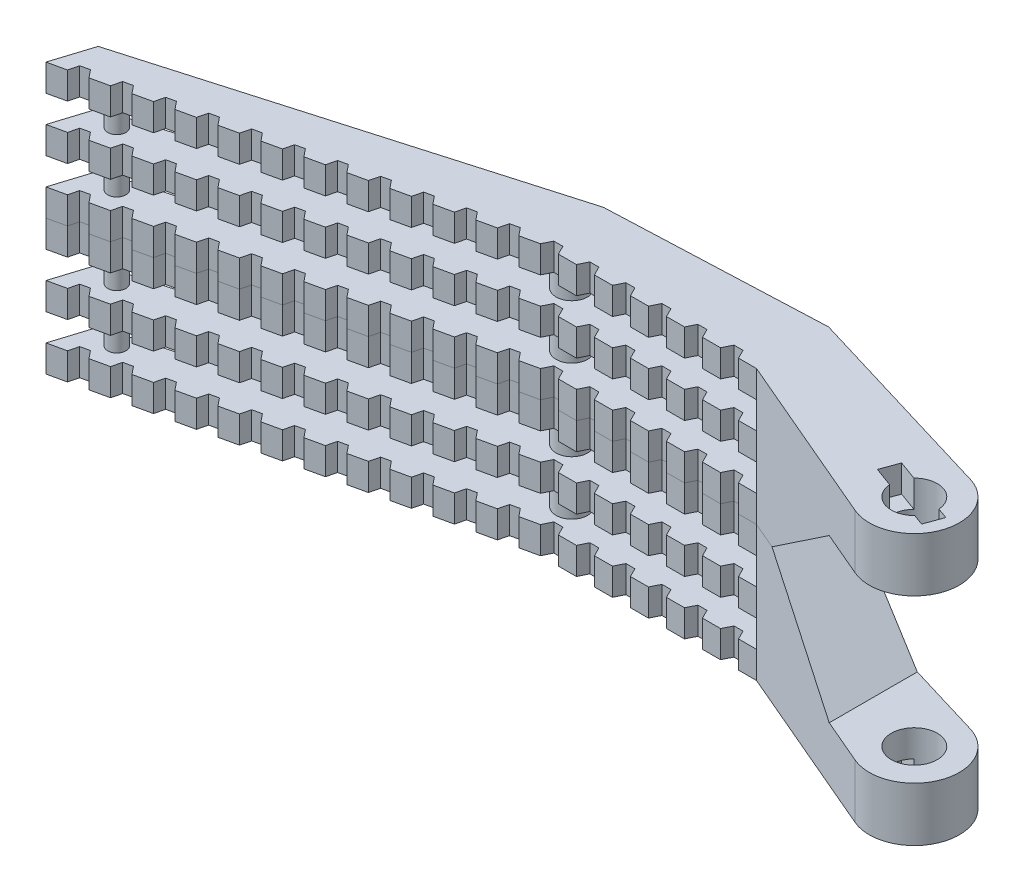
from build123d import *

# Parameters (mm, degrees)
EXTRUDE_2_DEPTH                = 15
EXTRUDE_2_DEPTH_BACK           = 15
CUT_EXTRUDE_7_DEPTH            = 92.973195193
CUT_EXTRUDE_7_DEPTH_BACK       = 92.973195193
CUT_EXTRUDE_8_DEPTH            = 92.973195193
CUT_EXTRUDE_8_DEPTH_BACK       = 92.973195193
SKETCH_3_W                     = 100
SKETCH_3_H                     = 3
EXTRUDE_START                  = -27
SKETCH_4_R                     = 1.75
SKETCH_4_R_2                   = 1
EXTRUDE_3_DEPTH                = 24
SKETCH_5_R                     = 2.55
CUT_EXTRUDE_2_DEPTH            = 96.572321485
CUT_EXTRUDE_5_DEPTH            = 3
SPLIT_BODIES_1_SURFACE_1_BACK  = 102.234
SPLIT_BODIES_1_SURFACE_1_DEPTH = 204.468
SPLIT_BODIES_1_SURFACE_2_BACK  = 102.234
SPLIT_BODIES_1_SURFACE_2_DEPTH = 204.468


with BuildPart() as part:
    # 草图1 → 凸台-拉伸2 (new, two sides: drawn at the far end of the back side and taken through both)
    with BuildSketch(Plane(origin=(0, 0, 0), x_dir=(1, 0, 0), z_dir=(0, 1, 0)).offset(-EXTRUDE_2_DEPTH_BACK)):
        with BuildLine():
            Line((-1.965078437, -4.597658832), (-21.095395232, 3.57880106))
            Line((-21.095395232, 3.57880106), (-23.095395232, 3.57880106))
            Line((-23.095395232, 3.57880106), (-23.595395232, 4.57880106))
            Line((-23.595395232, 4.57880106), (-24.595395232, 4.57880106))
            Line((-24.595395232, 4.57880106), (-25.095395232, 3.57880106))
            Line((-25.095395232, 3.57880106), (-27.095395232, 3.57880106))
            Line((-27.095395232, 3.57880106), (-27.595395232, 4.57880106))
            Line((-27.595395232, 4.57880106), (-28.595395232, 4.57880106))
            Line((-28.595395232, 4.57880106), (-29.095395232, 3.57880106))
            Line((-29.095395232, 3.57880106), (-31.095395232, 3.57880106))
            Line((-31.095395232, 3.57880106), (-31.595395232, 4.57880106))
            Line((-31.595395232, 4.57880106), (-32.595395232, 4.57880106))
            Line((-32.595395232, 4.57880106), (-33.095395232, 3.57880106))
            Line((-33.095395232, 3.57880106), (-35.095395232, 3.57880106))
            Line((-35.095395232, 3.57880106), (-35.595395232, 4.57880106))
            Line((-35.595395232, 4.57880106), (-36.595395232, 4.57880106))
            Line((-36.595395232, 4.57880106), (-37.095395232, 3.57880106))
            Line((-37.095395232, 3.57880106), (-39.095395232, 3.57880106))
            Line((-39.095395232, 3.57880106), (-39.595395232, 4.57880106))
            Line((-39.595395232, 4.57880106), (-40.595395232, 4.57880106))
            Line((-40.595395232, 4.57880106), (-41.095395232, 3.57880106))
            Line((-41.095395232, 3.57880106), (-43.095395232, 3.57880106))
            Line((-43.095395232, 3.57880106), (-43.595395232, 4.57880106))
            Line((-43.595395232, 4.57880106), (-44.595395232, 4.57880106))
            Line((-44.595395232, 4.57880106), (-45.095395232, 3.57880106))
            Line((-45.095395232, 3.57880106), (-47.047769352, 3.144940144))
            Line((-47.047769352, 3.144940144), (-47.75279334, 4.012661975))
            Line((-47.75279334, 4.012661975), (-48.7289804, 3.795731517))
            Line((-48.7289804, 3.795731517), (-49.000143472, 2.711079228))
            Line((-49.000143472, 2.711079228), (-50.952517593, 2.277218313))
            Line((-50.952517593, 2.277218313), (-51.657541581, 3.144940144))
            Line((-51.657541581, 3.144940144), (-52.633728641, 2.928009686))
            Line((-52.633728641, 2.928009686), (-52.904891713, 1.843357397))
            Line((-52.904891713, 1.843357397), (-54.857265833, 1.409496481))
            Line((-54.857265833, 1.409496481), (-55.562289821, 2.277218313))
            Line((-55.562289821, 2.277218313), (-56.538476881, 2.060287855))
            Line((-56.538476881, 2.060287855), (-56.809639954, 0.975635566))
            Line((-56.809639954, 0.975635566), (-58.762014074, 0.54177465))
            Line((-58.762014074, 0.54177465), (-59.467038062, 1.409496481))
            Line((-59.467038062, 1.409496481), (-60.443225122, 1.192566024))
            Line((-60.443225122, 1.192566024), (-60.714388194, 0.107913735))
            Line((-60.714388194, 0.107913735), (-62.666762315, -0.325947181))
            Line((-62.666762315, -0.325947181), (-63.371786303, 0.54177465))
            Line((-63.371786303, 0.54177465), (-64.347973363, 0.324844192))
            Line((-64.347973363, 0.324844192), (-64.619136435, -0.759808097))
            Line((-64.619136435, -0.759808097), (-66.571510556, -1.193669012))
            Line((-66.571510556, -1.193669012), (-67.276534543, -0.325947181))
            Line((-67.276534543, -0.325947181), (-68.252721604, -0.542877639))
            Line((-68.252721604, -0.542877639), (-68.523884676, -1.627529928))
            Line((-68.523884676, -1.627529928), (-70.476258796, -2.061390844))
            Line((-70.476258796, -2.061390844), (-71.181282784, -1.193669012))
            Line((-71.181282784, -1.193669012), (-72.157469844, -1.41059947))
            Line((-72.157469844, -1.41059947), (-72.428632917, -2.495251759))
            Line((-72.428632917, -2.495251759), (-74.381007037, -2.929112675))
            Line((-74.381007037, -2.929112675), (-75.086031025, -2.061390844))
            Line((-75.086031025, -2.061390844), (-76.062218085, -2.278321301))
            Line((-76.062218085, -2.278321301), (-76.333381157, -3.362973591))
            Line((-76.333381157, -3.362973591), (-78.285755278, -3.796834506))
            Line((-78.285755278, -3.796834506), (-78.990779266, -2.929112675))
            Line((-78.990779266, -2.929112675), (-79.966966326, -3.146043133))
            Line((-79.966966326, -3.146043133), (-80.238129398, -4.230695422))
            Line((-80.238129398, -4.230695422), (-82.190503519, -4.664556337))
            Line((-82.190503519, -4.664556337), (-82.895527506, -3.796834506))
            Line((-82.895527506, -3.796834506), (-83.871714567, -4.013764964))
            Line((-83.871714567, -4.013764964), (-84.142877639, -5.098417253))
            Line((-84.142877639, -5.098417253), (-86.095251759, -5.532278169))
            Line((-86.095251759, -5.532278169), (-86.800275747, -4.664556337))
            Line((-86.800275747, -4.664556337), (-87.776462807, -4.881486795))
            Line((-87.776462807, -4.881486795), (-88.04762588, -5.966139084))
            Line((-88.04762588, -5.966139084), (-90, -6.4))
            Line((-90, -6.4), (-88.613314383, -1.994272326))
            Line((-88.613314383, -1.994272326), (-45.095395232, 10.57880106))
            Line((-45.095395232, 10.57880106), (-21.095395232, 11.57880106))
            Line((-21.095395232, 11.57880106), (1.442591054, 4.78737204))
            ThreePointArc((1.442591054, 4.78737204), (4.699781844, -1.706473152), (-1.965078437, -4.597658832))
        make_face()
    extrude(amount=EXTRUDE_2_DEPTH + EXTRUDE_2_DEPTH_BACK)

    # 草图10 → 切除-拉伸7 (cut, two sides: drawn at the far end of the back side and taken through both)
    with BuildSketch(Plane.XY.offset(-CUT_EXTRUDE_7_DEPTH_BACK)):
        Polygon((5, 9), (-7, 9), (-18.095395232, 0), (-7, -9), (5, -9), align=None)
    extrude(amount=CUT_EXTRUDE_7_DEPTH + CUT_EXTRUDE_7_DEPTH_BACK, mode=Mode.SUBTRACT)

    # 草图3 → 切除-拉伸8 (cut, two sides: drawn at the far end of the back side and taken through both)
    with BuildSketch(Plane.XY.offset(-CUT_EXTRUDE_8_DEPTH_BACK)):
        with Locations((-71.095395232, 10.5)):
            Rectangle(SKETCH_3_W, SKETCH_3_H)
        with Locations((-71.095395232, 4.5)):
            Rectangle(SKETCH_3_W, SKETCH_3_H)
        with Locations((-71.095395232, -4.5)):
            Rectangle(SKETCH_3_W, SKETCH_3_H)
        with Locations((-71.095395232, -10.5)):
            Rectangle(SKETCH_3_W, SKETCH_3_H)
    extrude(amount=CUT_EXTRUDE_8_DEPTH + CUT_EXTRUDE_8_DEPTH_BACK, mode=Mode.SUBTRACT)

    # 草图4 → 凸台-拉伸3 (add)
    with BuildSketch(Plane.XZ.offset(15).offset(EXTRUDE_START)):
        with Locations(Location((-45.095395232, -7.07880106, 0), (0, 0, 270))):
            Circle(SKETCH_4_R)
        with Locations(Location((-85.795199954, 2.741420949, 0), (0, 0, 270))):
            Circle(SKETCH_4_R_2)
    extrude(amount=EXTRUDE_3_DEPTH)

    # 草图5 → 切除-拉伸2 (cut, through all)
    with BuildSketch(Plane.XZ.offset(15)):
        with Locations(Location((0, 0, 0), (0, 0, 270))):
            Circle(SKETCH_5_R)
    extrude(amount=-CUT_EXTRUDE_2_DEPTH, mode=Mode.SUBTRACT)

    # 草图8 → 切除-拉伸5 (cut)
    with BuildSketch(Plane.XZ.offset(15)):
        Polygon((-4.682158658, -0.583001112), (-3.965439935, -2.556909487), (3.74220229, 0.241706482), (3.025483566, 2.215614856), align=None)
    cut_extrude_5 = extrude(amount=-CUT_EXTRUDE_5_DEPTH, mode=Mode.SUBTRACT)

    # 镜向1: 切除-拉伸5 across plane
    add(cut_extrude_5.mirror(Plane.ZX), mode=Mode.SUBTRACT)


with BuildPart() as body_2:
    # Split Bodies 1: the piece behind the surface
    add(part.part)
    # Split Bodies 1 surface: a surface, the sketch's curves swept straight by 204.468 mm
    with BuildLine(Plane.XY.offset(-SPLIT_BODIES_1_SURFACE_1_BACK), mode=Mode.PRIVATE) as split_bodies_1_surface_1_path:
        Line((-94.805800959, 0), (15.621875769, 0))
    split_bodies_1_surface_1 = Shell.extrude(split_bodies_1_surface_1_path.wire(), (0 * SPLIT_BODIES_1_SURFACE_1_DEPTH, 0 * SPLIT_BODIES_1_SURFACE_1_DEPTH, 1 * SPLIT_BODIES_1_SURFACE_1_DEPTH))
    split(bisect_by=split_bodies_1_surface_1, keep=Keep.BOTTOM)


with BuildPart() as part_1:
    add(part.part)

    # Split Bodies 1: split by a surface, the side it looks to stays
    # Split Bodies 1 surface: a surface, the sketch's curves swept straight by 204.468 mm
    with BuildLine(Plane.XY.offset(-SPLIT_BODIES_1_SURFACE_2_BACK), mode=Mode.PRIVATE) as split_bodies_1_surface_2_path:
        Line((-94.805800959, 0), (15.621875769, 0))
    split_bodies_1_surface_2 = Shell.extrude(split_bodies_1_surface_2_path.wire(), (0 * SPLIT_BODIES_1_SURFACE_2_DEPTH, 0 * SPLIT_BODIES_1_SURFACE_2_DEPTH, 1 * SPLIT_BODIES_1_SURFACE_2_DEPTH))
    split(bisect_by=split_bodies_1_surface_2, keep=Keep.TOP)


solid = Compound([body_2.part, part_1.part])
